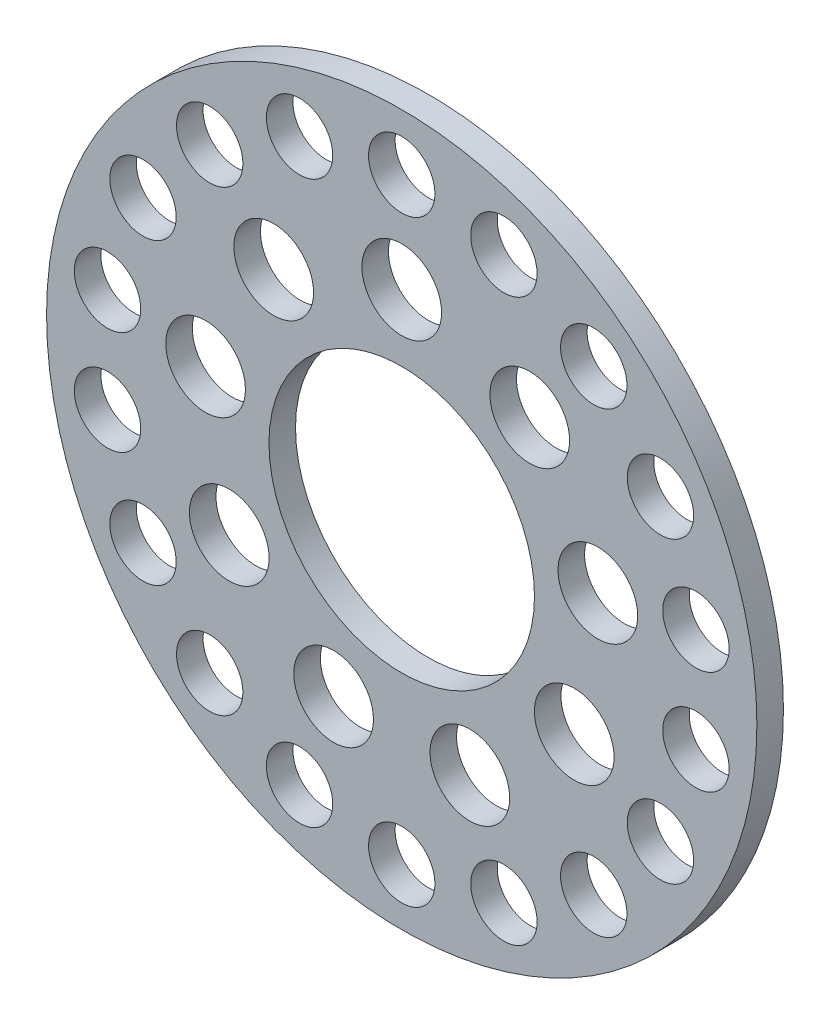
from build123d import *

# Parameters (mm, degrees)
SKETCH1_R           = 26.75
SKETCH1_R_2         = 10
SKETCH1_R_3         = 2.5
SKETCH1_R_4         = 3
BOSS_EXTRUDE1_DEPTH = 2


with BuildPart() as part:
    # Sketch1 → Boss-Extrude1 (new body)
    with BuildSketch(Plane.XY):
        Circle(SKETCH1_R)
        Circle(SKETCH1_R_2, mode=Mode.SUBTRACT)
        with Locations((0, 22.5)):
            Circle(SKETCH1_R_3, mode=Mode.SUBTRACT)
        with Locations((7.695453225, 21.143083968)):
            Circle(SKETCH1_R_3, mode=Mode.SUBTRACT)
        with Locations((14.462721218, 17.23599997)):
            Circle(SKETCH1_R_3, mode=Mode.SUBTRACT)
        with Locations((19.485571585, 11.25)):
            Circle(SKETCH1_R_3, mode=Mode.SUBTRACT)
        with Locations((22.158174443, 3.907083998)):
            Circle(SKETCH1_R_3, mode=Mode.SUBTRACT)
        with Locations((22.158174443, -3.907083998)):
            Circle(SKETCH1_R_3, mode=Mode.SUBTRACT)
        with Locations((19.485571585, -11.25)):
            Circle(SKETCH1_R_3, mode=Mode.SUBTRACT)
        with Locations((14.462721218, -17.23599997)):
            Circle(SKETCH1_R_3, mode=Mode.SUBTRACT)
        with Locations((7.695453225, -21.143083968)):
            Circle(SKETCH1_R_3, mode=Mode.SUBTRACT)
        with Locations((0, -22.5)):
            Circle(SKETCH1_R_3, mode=Mode.SUBTRACT)
        with Locations((-7.695453225, -21.143083968)):
            Circle(SKETCH1_R_3, mode=Mode.SUBTRACT)
        with Locations((-14.462721218, -17.23599997)):
            Circle(SKETCH1_R_3, mode=Mode.SUBTRACT)
        with Locations((-19.485571585, -11.25)):
            Circle(SKETCH1_R_3, mode=Mode.SUBTRACT)
        with Locations((-22.158174443, -3.907083998)):
            Circle(SKETCH1_R_3, mode=Mode.SUBTRACT)
        with Locations((-22.158174443, 3.907083998)):
            Circle(SKETCH1_R_3, mode=Mode.SUBTRACT)
        with Locations((-19.485571585, 11.25)):
            Circle(SKETCH1_R_3, mode=Mode.SUBTRACT)
        with Locations((-14.462721218, 17.23599997)):
            Circle(SKETCH1_R_3, mode=Mode.SUBTRACT)
        with Locations((-7.695453225, 21.143083968)):
            Circle(SKETCH1_R_3, mode=Mode.SUBTRACT)
        with Locations((0, 15)):
            Circle(SKETCH1_R_4, mode=Mode.SUBTRACT)
        with Locations((9.641814145, 11.490666647)):
            Circle(SKETCH1_R_4, mode=Mode.SUBTRACT)
        with Locations((14.772116295, 2.604722665)):
            Circle(SKETCH1_R_4, mode=Mode.SUBTRACT)
        with Locations((12.990381057, -7.5)):
            Circle(SKETCH1_R_4, mode=Mode.SUBTRACT)
        with Locations((5.13030215, -14.095389312)):
            Circle(SKETCH1_R_4, mode=Mode.SUBTRACT)
        with Locations((-5.13030215, -14.095389312)):
            Circle(SKETCH1_R_4, mode=Mode.SUBTRACT)
        with Locations((-12.990381057, -7.5)):
            Circle(SKETCH1_R_4, mode=Mode.SUBTRACT)
        with Locations((-14.772116295, 2.604722665)):
            Circle(SKETCH1_R_4, mode=Mode.SUBTRACT)
        with Locations((-9.641814145, 11.490666647)):
            Circle(SKETCH1_R_4, mode=Mode.SUBTRACT)
    extrude(amount=BOSS_EXTRUDE1_DEPTH)


solid = part.part
